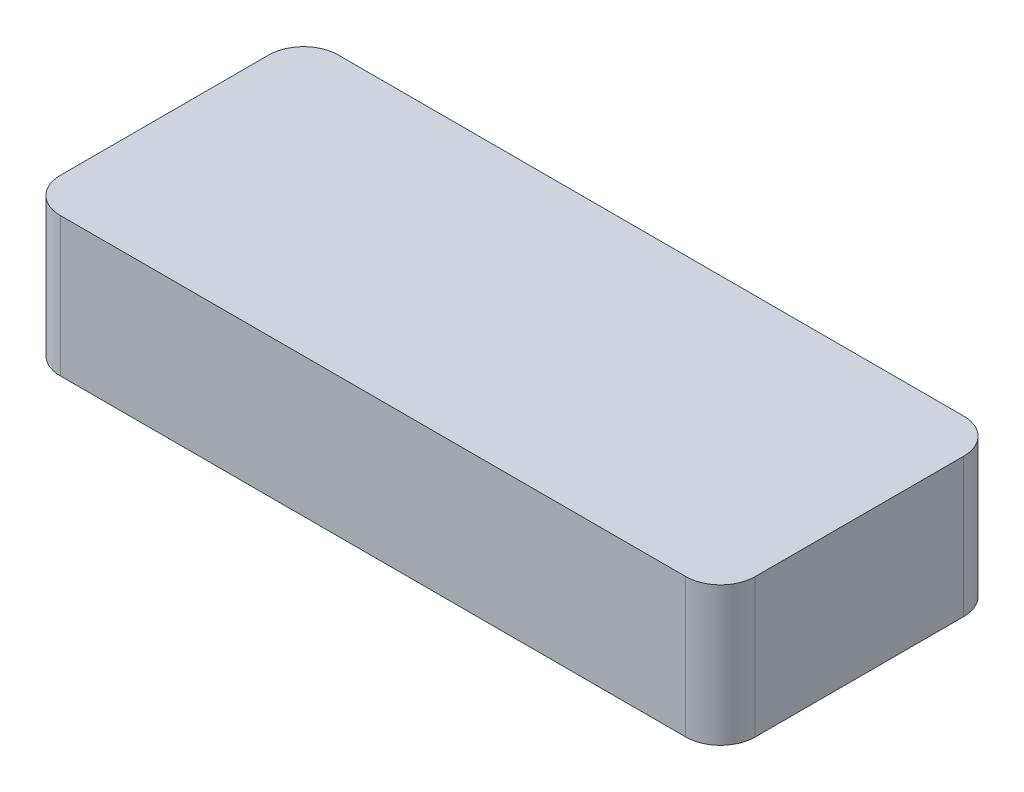
from build123d import *

# Parameters (mm, degrees)
SKETCH1_W           = 31.75
SKETCH1_H           = 12.7
BOSS_EXTRUDE1_DEPTH = 6.35
FILLET1_R           = 1.5875


with BuildPart() as part:
    # Sketch1 → Boss-Extrude1 (new body)
    with BuildSketch(Plane(origin=(0, 0, 0), x_dir=(1, 0, 0), z_dir=(0, 1, 0))):
        Rectangle(SKETCH1_W, SKETCH1_H)
    extrude(amount=BOSS_EXTRUDE1_DEPTH)

    # Fillet1
    fillet1_edges = [part.edges().sort_by_distance(p)[0] for p in [
        (15.875, 3.175, 6.35),
        (-15.875, 3.175, 6.35),
        (-15.875, 3.175, -6.35),
        (15.875, 3.175, -6.35),
    ]]
    fillet(fillet1_edges, radius=FILLET1_R)


solid = part.part
